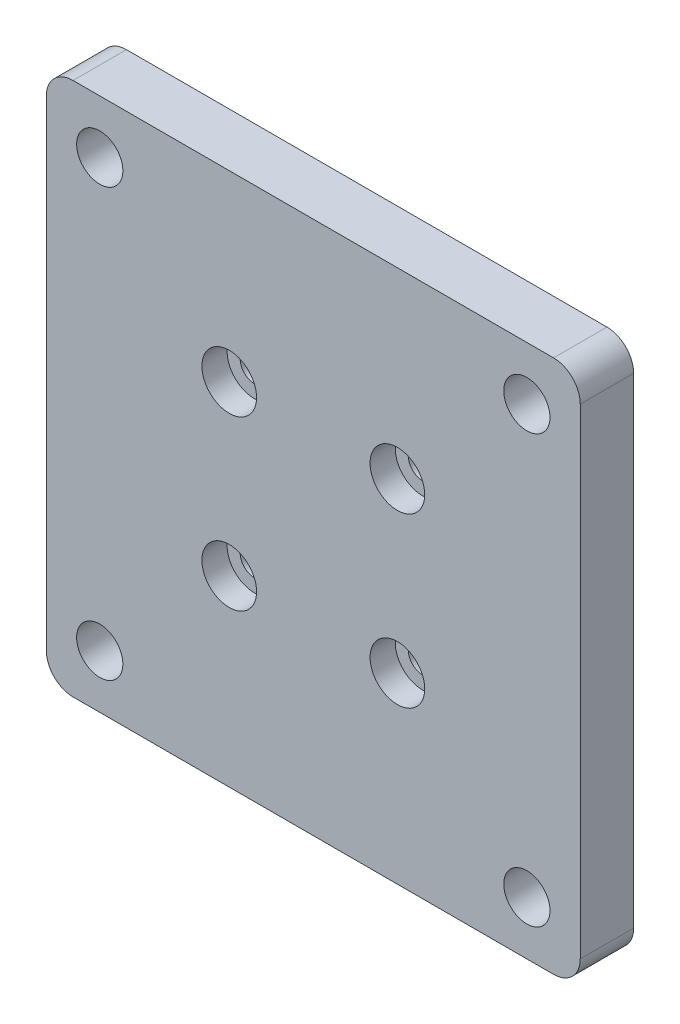
from build123d import *

# Parameters (mm, degrees)
SKETCH1_W                      = 63.5
SKETCH1_H                      = 63.5
BOSS_EXTRUDE1_DEPTH            = 3.175
CBORE_FOR_M3_SHCS1_D           = 3.4
CBORE_FOR_M3_SHCS1_CBORE_D     = 6.5
CBORE_FOR_M3_SHCS1_CBORE_DEPTH = 3
M5_CLEARANCE_HOLE1_D           = 5.5
FILLET1_R                      = 3.175


with BuildPart() as part:
    # Sketch1 → Boss-Extrude1 (new, symmetric)
    with BuildSketch(Plane.XY):
        Rectangle(SKETCH1_W, SKETCH1_H)
    extrude(amount=BOSS_EXTRUDE1_DEPTH, both=True)

    # CBORE for M3 SHCS1 (through all)
    with Locations(Plane.XY.offset(3.175)):
        with Locations((-10, -10), (10, 10), (-10, 10), (10, -10)):
            CounterBoreHole(CBORE_FOR_M3_SHCS1_D / 2, CBORE_FOR_M3_SHCS1_CBORE_D / 2, CBORE_FOR_M3_SHCS1_CBORE_DEPTH)

    # M5 Clearance Hole1 (through all)
    with Locations(Plane.XY.offset(3.175)):
        with Locations((-25.4, -25.4), (-25.4, 25.4), (25.4, -25.4), (25.4, 25.4)):
            Hole(M5_CLEARANCE_HOLE1_D / 2)

    # Fillet1
    fillet1_edges = [part.edges().sort_by_distance(p)[0] for p in [
        (-31.75, 31.75, 0),
        (31.75, 31.75, 0),
        (31.75, -31.75, 0),
        (-31.75, -31.75, 0),
    ]]
    fillet(fillet1_edges, radius=FILLET1_R)


solid = part.part
